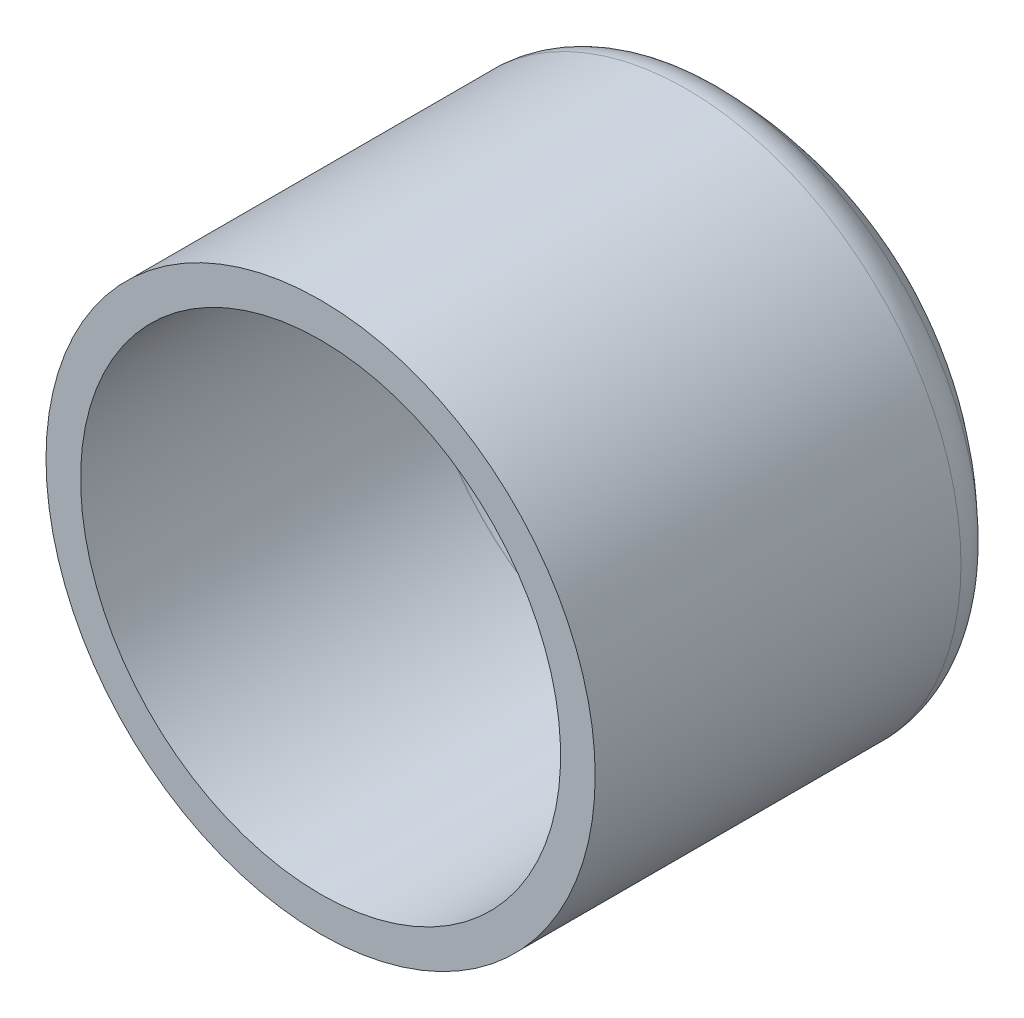
from build123d import *

# Parameters (mm, degrees)
FILLET1_R = 6.35


with BuildPart() as part:
    # Sketch2 → Revolve1 (revolve)
    with BuildSketch(Plane(origin=(0, 0, 0), x_dir=(0, 0, -1), z_dir=(1, 0, 0))):
        with BuildLine():
            Line((31.9532, 0), (38.4048, 0))
            ThreePointArc((38.4048, 0), (33.626354024, -22.897899672), (20.088672263, -41.9735))
            Line((20.088672263, -41.9735), (-38.4048, -41.9735))
            Line((-38.4048, -41.9735), (-38.4048, -36.6903))
            Line((-38.4048, -36.6903), (12.3952, -36.4236))
            Line((12.3952, -36.4236), (12.459604186, -36.4236))
            ThreePointArc((12.459604186, -36.4236), (16.434552807, -35.554546422), (19.684158998, -33.105969231))
            ThreePointArc((19.684158998, -33.105969231), (28.787288199, -17.653148202), (31.9532, 0))
        make_face()
    revolve(axis=Axis((0, 0, 38.4048), (0, 0, -1)))

    # Fillet1
    fillet1_edges = [part.edges().sort_by_distance(p)[0] for p in [
        (0, 41.9735, -20.088672263),
    ]]
    fillet(fillet1_edges, radius=FILLET1_R)


solid = part.part
